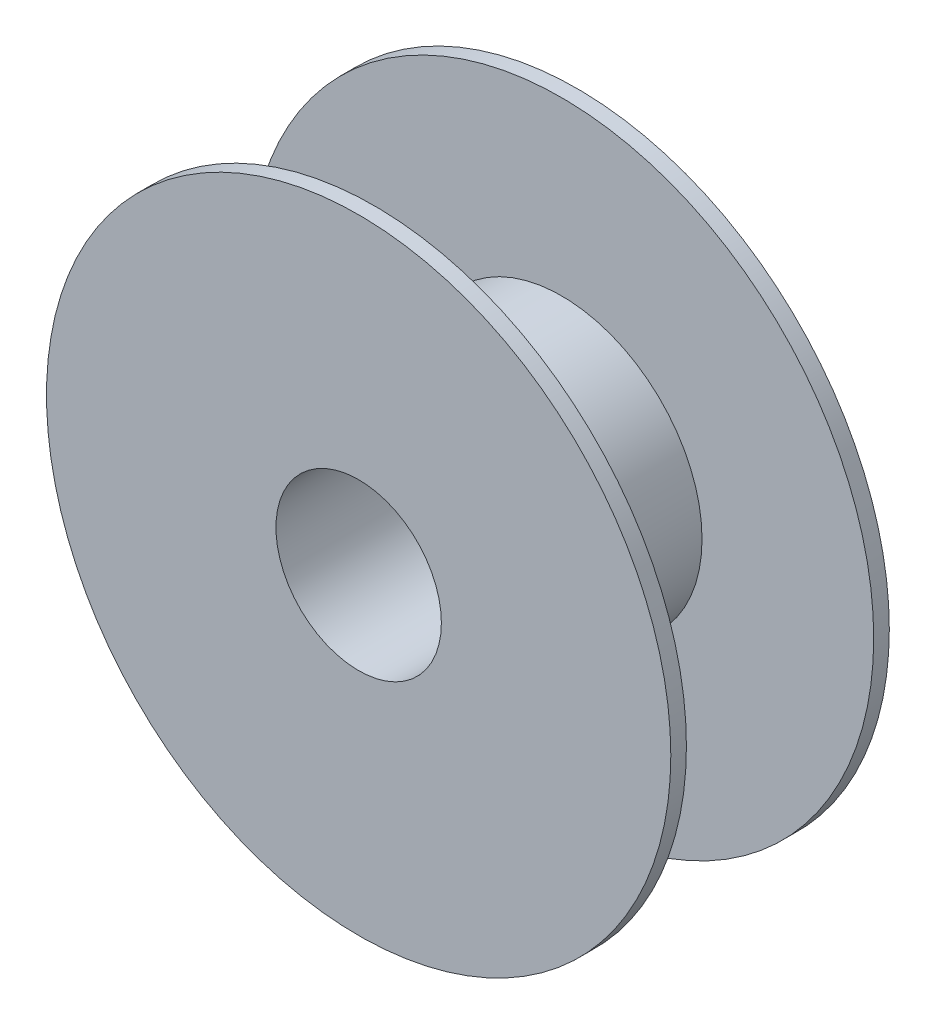
from build123d import *

# Parameters (mm, degrees)
SKETCH1_R           = 100
SKETCH1_R_2         = 26.5
BOSS_EXTRUDE1_DEPTH = 70
SKETCH2_W           = 55
SKETCH2_H           = 60


with BuildPart() as part:
    # Sketch1 → Boss-Extrude1 (new body)
    with BuildSketch(Plane.XY):
        Circle(SKETCH1_R)
        Circle(SKETCH1_R_2, mode=Mode.SUBTRACT)
    extrude(amount=BOSS_EXTRUDE1_DEPTH)

    # Sketch2 → Cut-Revolve1 (revolve, cut)
    with BuildSketch(Plane(origin=(0, 0, 0), x_dir=(1, 0, 0), z_dir=(0, 1, 0)), mode=Mode.PRIVATE) as cut_revolve1_sk:
        with Locations((-72.5, -35)):
            Rectangle(SKETCH2_W, SKETCH2_H)
    revolve(cut_revolve1_sk.sketch.rotate(Axis((0, 0, 0), (0, 0, -1)), 180), axis=Axis((0, 0, 0), (0, 0, -1)), mode=Mode.SUBTRACT)


solid = part.part
